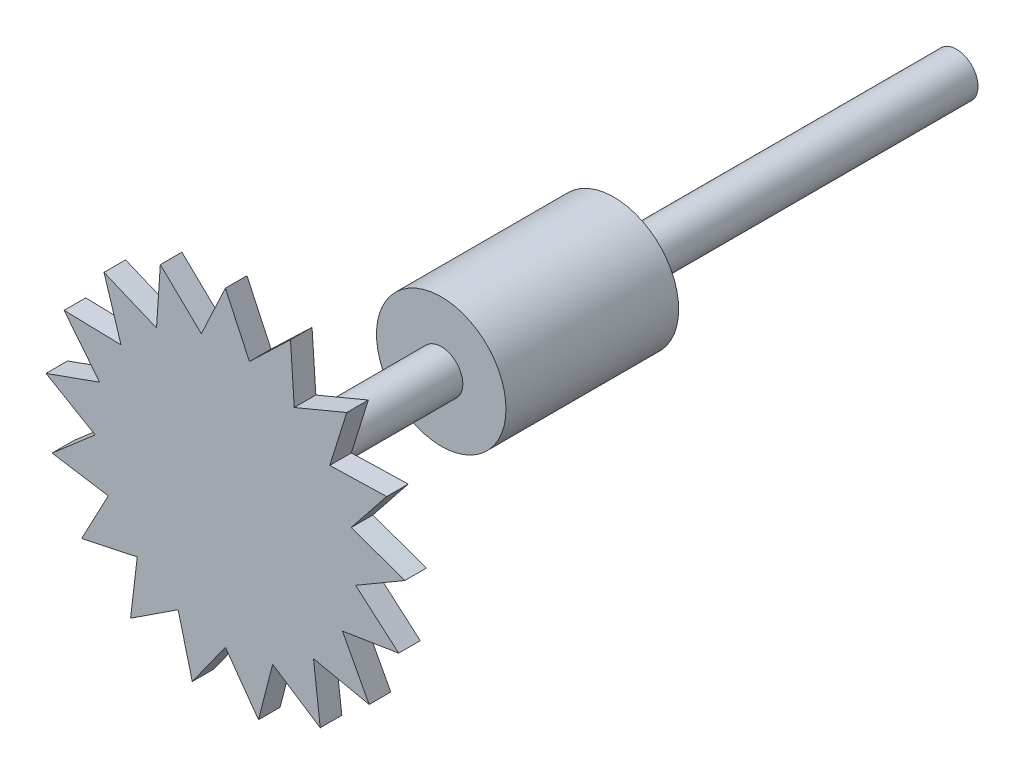
from build123d import *

# Parameters (mm, degrees)
BOSS_EXTRU_1_DEPTH      = 20
BOSS_EXTRU_1_DEPTH_BACK = 20
ESQUISSE1_R             = 15
ESQUISSE2_R             = 5
BOSS_EXTRU_2_DEPTH      = 50
BOSS_EXTRU_4_DEPTH      = 5
BOSS_EXTRU_5_START      = 79.35
ESQUISSE5_R             = 5
BOSS_EXTRU_5_DEPTH      = 79.35


with BuildPart() as part:
    # Esquisse1 → Boss.-Extru.1 (new, two sides: drawn at the far end of the back side and taken through both)
    with BuildSketch(Plane.XY.offset(-BOSS_EXTRU_1_DEPTH_BACK)):
        Circle(ESQUISSE1_R)
    extrude(amount=BOSS_EXTRU_1_DEPTH + BOSS_EXTRU_1_DEPTH_BACK)

    # Esquisse2 → Boss.-Extru.2 (add)
    with BuildSketch(Plane.XY.offset(20)):
        Circle(ESQUISSE2_R)
    extrude(amount=BOSS_EXTRU_2_DEPTH)

    # Esquisse3 → Boss.-Extru.4 (add)
    with BuildSketch(Plane.XY.offset(70)):
        Polygon((-1.571578965, 38.361483473), (-5.568168614, 29.787071155), (-12.392312465, 36.338737822), (-15.075770583, 38.915049734), (-15.323219948, 35.203298214), (-15.952493815, 25.76416214), (-24.682553429, 29.408244268), (-28.115474811, 30.841206699), (-27.005375168, 27.290712462), (-24.182346331, 18.261660264), (-33.639278782, 18.506004369), (-37.358028372, 18.602087802), (-35.04030483, 15.69236477), (-29.146238976, 8.292819978), (-38.052833133, 5.104426035), (-41.555173194, 3.85065387), (-38.342847159, 1.974676262), (-30.173770542, -2.796011598), (-37.327141512, -8.98653332), (-40.140061611, -11.420832204), (-36.466975515, -12.009703218), (-27.126167198, -13.507226314), (-31.560212593, -21.863811553), (-33.303812283, -25.149871604), (-29.666036756, -24.37210573), (-20.415024663, -22.39421527), (-21.530902082, -31.788260884), (-21.969698564, -35.482281483), (-18.858535349, -33.442920312), (-10.946719923, -28.256741363), (-8.593723938, -37.419529438), (-7.668455316, -41.022612634), (-5.504084244, -37.997083192), (0, -30.303037958), (5.504084244, -37.997083192), (7.668455316, -41.022612634), (8.593723938, -37.419529438), (10.946719923, -28.256741363), (18.858535349, -33.442920312), (21.969698564, -35.482281483), (21.530902082, -31.788260884), (20.415024663, -22.39421527), (29.666036756, -24.37210573), (33.303812283, -25.149871604), (31.560212593, -21.863811553), (27.126167198, -13.507226314), (36.466975515, -12.009703218), (40.140061611, -11.420832204), (37.327141512, -8.98653332), (30.173770542, -2.796011598), (38.342847159, 1.974676262), (41.555173194, 3.85065387), (38.052833133, 5.104426035), (29.146238976, 8.292819978), (35.04030483, 15.69236477), (37.358028372, 18.602087802), (33.639278782, 18.506004369), (24.182346331, 18.261660264), (27.005375168, 27.290712462), (28.115474811, 30.841206699), (24.682553429, 29.408244268), (15.952493815, 25.76416214), (15.323219948, 35.203298214), (15.075770583, 38.915049734), (12.392312465, 36.338737822), (5.568168614, 29.787071155), (1.571578965, 38.361483473), (0, 41.733199668), align=None)
    extrude(amount=-BOSS_EXTRU_4_DEPTH)

    # Esquisse5 → Boss.-Extru.5 (add)
    with BuildSketch(Plane(origin=(0, 0, -20), x_dir=(-1, 0, 0), z_dir=(0, 0, -1)).offset(BOSS_EXTRU_5_START)):
        Circle(ESQUISSE5_R)
    extrude(amount=-BOSS_EXTRU_5_DEPTH)


solid = part.part
